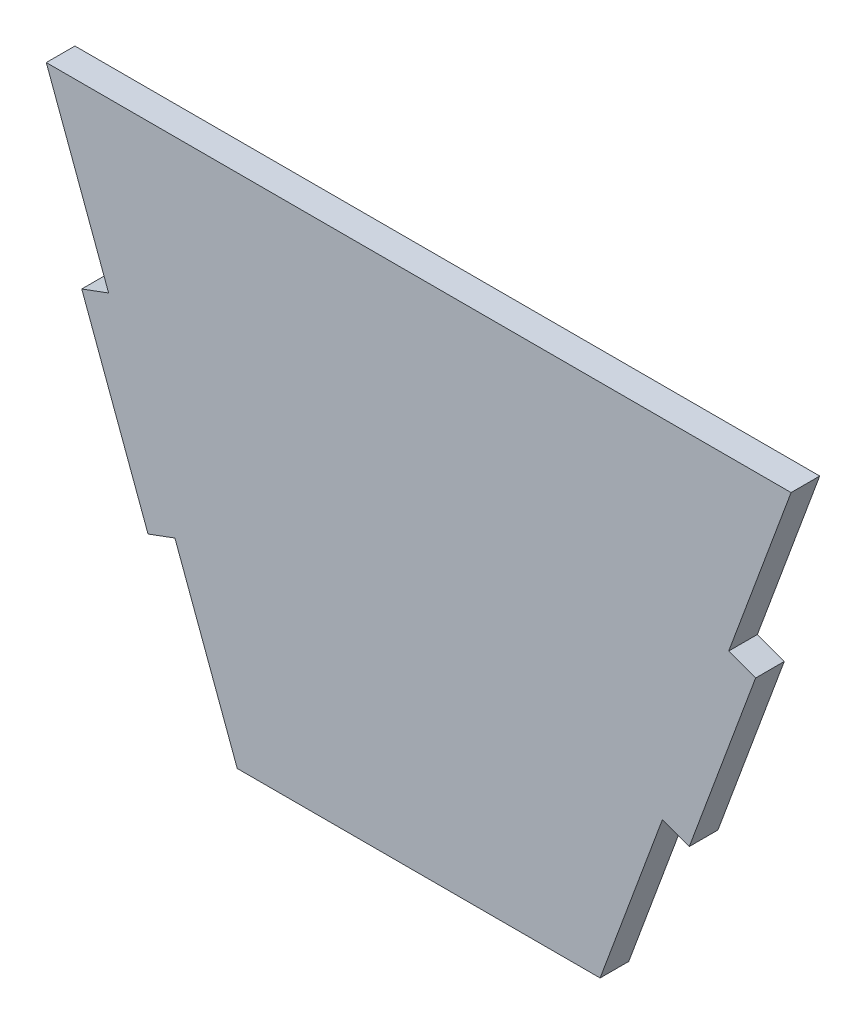
from build123d import *

# Parameters (mm, degrees)
BOSS_EXTRU_1_DEPTH = 3


with BuildPart() as part:
    # Esquisse1 → Boss.-Extru.1 (new body)
    with BuildSketch(Plane.XY):
        Polygon((0, 0), (78, 0), (71.471619511, -17.635426652), (74.285035089, -18.676912505), (67.341796068, -37.433016362), (64.528380489, -36.391530509), (58, -54.02695716), (20, -54.02695716), (13.471619511, -36.391530509), (10.658203932, -37.433016362), (3.714964911, -18.676912505), (6.528380489, -17.635426652), align=None)
    extrude(amount=BOSS_EXTRU_1_DEPTH)


solid = part.part
